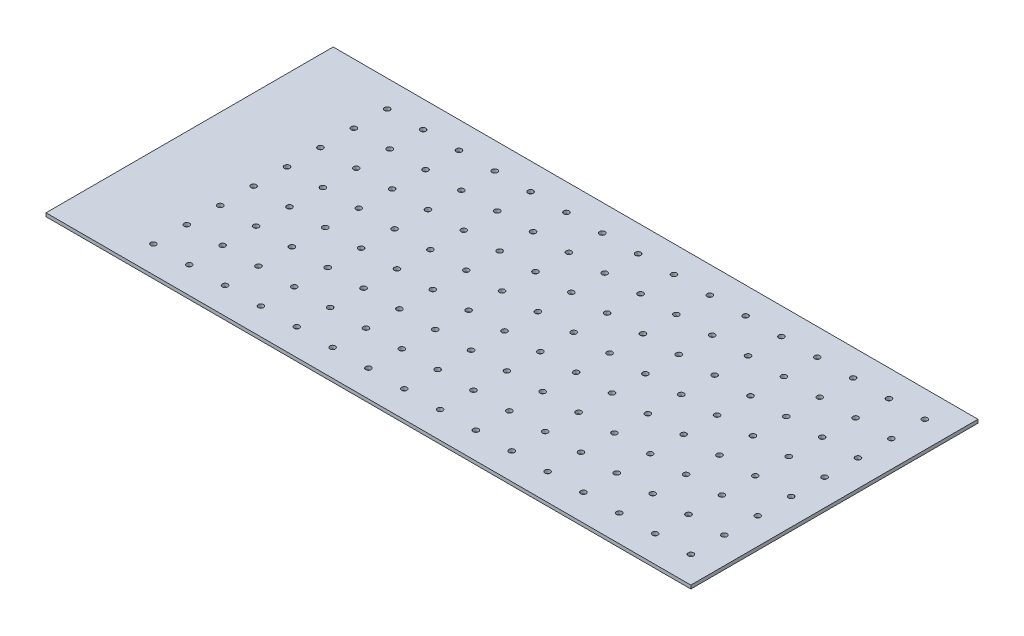
from build123d import *

# Parameters (mm, degrees)
SKETCH1_W            = 545
SKETCH1_H            = 265
BOSS_EXTRUDE1_DEPTH  = 3.18
CUT_EXTRUDE1_REACH   = 305.022
SKETCH4_R            = 2.5
LPATTERN1_COUNT      = 16
LPATTERN1_PITCH      = 33.066666667
LPATTERN1_COUNT_DIR2 = 8
LPATTERN1_PITCH_DIR2 = 30.828571429
SKETCH5_W            = 265
SKETCH5_H            = 3.18
BOSS_EXTRUDE2_DEPTH  = 50


with BuildPart() as part:
    # Sketch1 → Boss-Extrude1 (new body)
    with BuildSketch(Plane(origin=(0, 0, 0), x_dir=(1, 0, 0), z_dir=(0, 1, 0))):
        Rectangle(SKETCH1_W, SKETCH1_H)
    extrude(amount=BOSS_EXTRUDE1_DEPTH)

    # Sketch4 → Cut-Extrude1 (cut, up to next)
    with BuildSketch(Plane(origin=(0, 3.18, 0), x_dir=(1, 0, 0), z_dir=(0, 1, 0)), mode=Mode.PRIVATE) as cut_extrude1_sk1:
        with Locations(Location((-248, 107.9, 0), (0, 0, 270))):
            Circle(SKETCH4_R)
    cut_extrude1_tool1 = extrude(cut_extrude1_sk1.sketch, amount=-CUT_EXTRUDE1_REACH, mode=Mode.PRIVATE) & part.part
    cut_extrude1 = cut_extrude1_tool1.solids().sort_by_distance((-248, 3.18, -107.9))[0]
    add(cut_extrude1, mode=Mode.SUBTRACT)

    # LPattern1: Cut-Extrude1 16 × 8
    with Locations(*[(i * LPATTERN1_PITCH, 0, j * LPATTERN1_PITCH_DIR2) for i in range(LPATTERN1_COUNT) for j in range(LPATTERN1_COUNT_DIR2) if (i, j) != (0, 0)]):
        add(cut_extrude1, mode=Mode.SUBTRACT)

    # Sketch5 → Boss-Extrude2 (add)
    with BuildSketch(Plane.ZY.offset(272.5)):
        with Locations((0, 1.59)):
            Rectangle(SKETCH5_W, SKETCH5_H)
    extrude(amount=BOSS_EXTRUDE2_DEPTH)


solid = part.part
